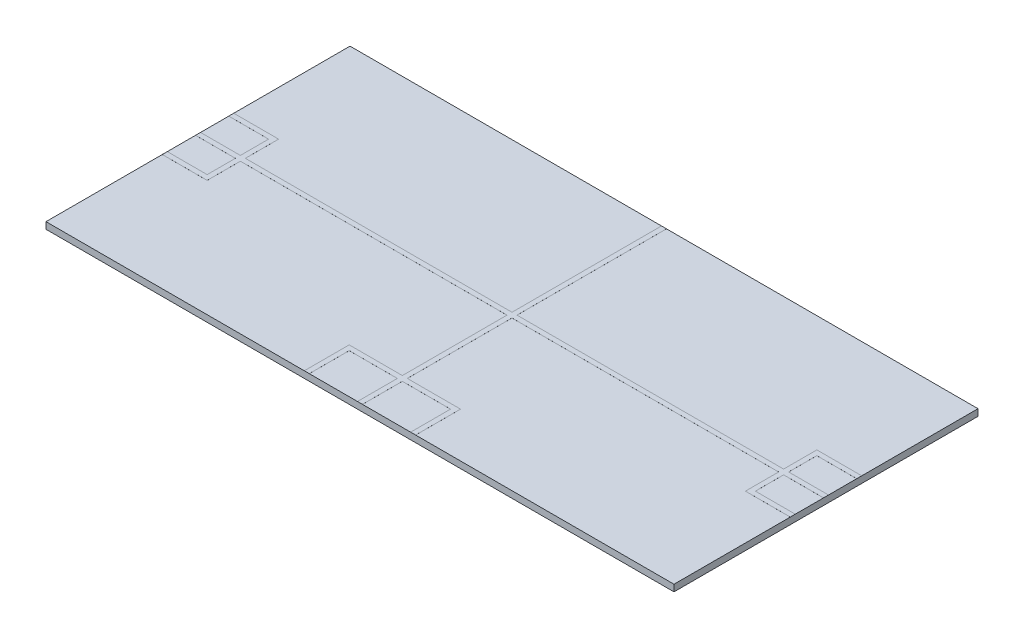
from build123d import *

# Parameters (mm, degrees)
SKETCH1_W           = 2400.3
SKETCH1_H           = 1162.05
BOSS_EXTRUDE1_DEPTH = 25.4
BOSS_EXTRUDE2_DEPTH = 0.127


with BuildPart() as part:
    # Sketch1 → Boss-Extrude1 (new body)
    with BuildSketch(Plane(origin=(0, 0, 0), x_dir=(1, 0, 0), z_dir=(0, 1, 0))):
        Rectangle(SKETCH1_W, SKETCH1_H)
    extrude(amount=BOSS_EXTRUDE1_DEPTH)

    # Sketch2 → Boss-Extrude2 (add)
    with BuildSketch(Plane(origin=(0, 25.4, 0), x_dir=(1, 0, 0), z_dir=(0, 1, 0))):
        Polygon((-1200.15, 136.525), (-1028.7, 136.525), (-1028.7, 9.525), (-9.525, 9.525), (-9.525, 581.025), (9.525, 581.025), (9.525, 9.525), (1028.7, 9.525), (1028.7, 136.525), (1200.15, 136.525), (1200.15, 117.475), (1047.75, 117.475), (1047.75, 9.525), (1200.15, 9.525), (1200.15, -9.525), (1047.75, -9.525), (1047.75, -117.475), (1200.15, -117.475), (1200.15, -136.525), (1028.7, -136.525), (1028.7, -9.525), (9.525, -9.525), (9.525, -409.575), (212.725, -409.575), (212.725, -581.025), (193.675, -581.025), (193.675, -428.625), (9.525, -428.625), (9.525, -581.025), (-9.525, -581.025), (-9.525, -428.625), (-193.675, -428.625), (-193.675, -581.025), (-212.725, -581.025), (-212.725, -409.575), (-9.525, -409.575), (-9.525, -9.525), (-1028.7, -9.525), (-1028.7, -136.525), (-1200.15, -136.525), (-1200.15, -117.475), (-1047.75, -117.475), (-1047.75, -9.525), (-1200.15, -9.525), (-1200.15, 9.525), (-1047.75, 9.525), (-1047.75, 117.475), (-1200.15, 117.475), align=None)
    extrude(amount=BOSS_EXTRUDE2_DEPTH)


solid = part.part
